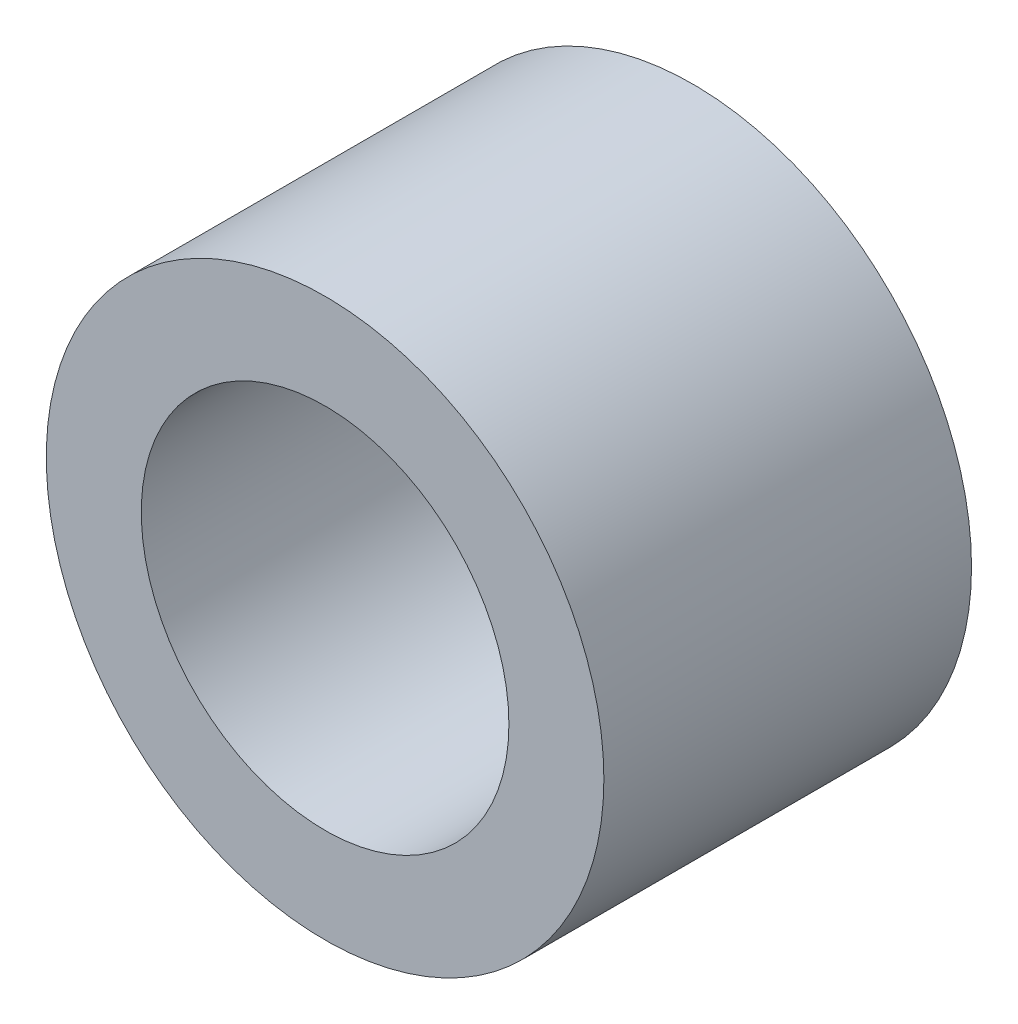
from build123d import *

# Parameters (mm, degrees)
SKETCH1_R           = 2.275
SKETCH1_R_2         = 1.5
BOSS_EXTRUDE1_DEPTH = 3


with BuildPart() as part:
    # Sketch1 → Boss-Extrude1 (new body)
    with BuildSketch(Plane.XY):
        Circle(SKETCH1_R)
        Circle(SKETCH1_R_2, mode=Mode.SUBTRACT)
    extrude(amount=BOSS_EXTRUDE1_DEPTH)


solid = part.part
